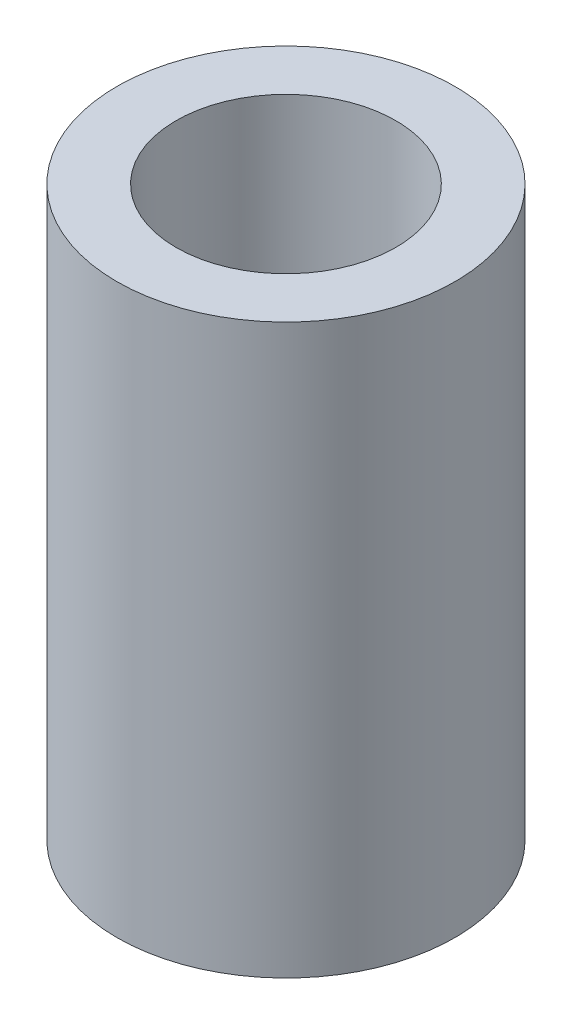
from build123d import *

# Parameters (mm, degrees)
SKETCH1_R           = 2.5
SKETCH1_R_2         = 1.625
BOSS_EXTRUDE1_DEPTH = 8.4


with BuildPart() as part:
    # Sketch1 → Boss-Extrude1 (new body)
    with BuildSketch(Plane(origin=(0, 0, 0), x_dir=(1, 0, 0), z_dir=(0, 1, 0))):
        with Locations(Location((0, 0, 0), (0, 0, 270))):
            Circle(SKETCH1_R)
        with Locations(Location((0, 0, 0), (0, 0, 270))):
            Circle(SKETCH1_R_2, mode=Mode.SUBTRACT)
    extrude(amount=BOSS_EXTRUDE1_DEPTH)


solid = part.part
